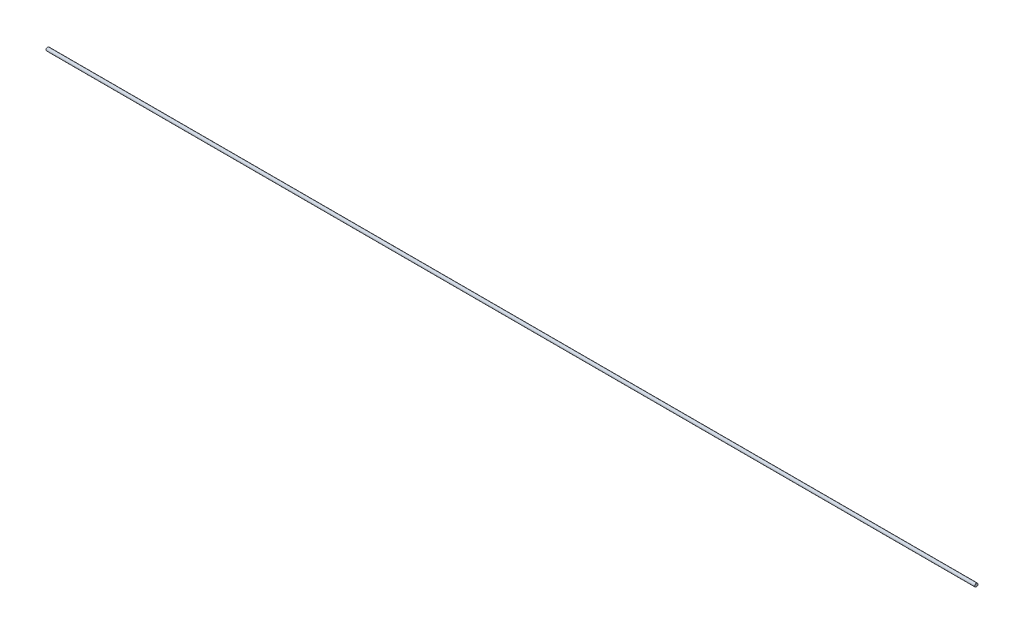
from build123d import *

# Parameters (mm, degrees)
SKETCH2_R           = 1.0287
BOSS_EXTRUDE1_DEPTH = 578.749999978


with BuildPart() as part:
    # Sketch2 → Boss-Extrude1 (new body)
    with BuildSketch(Plane(origin=(0, 0, 0), x_dir=(0, 0, -1), z_dir=(1, 0, 0))):
        Circle(SKETCH2_R)
    extrude(amount=BOSS_EXTRUDE1_DEPTH)


solid = part.part
